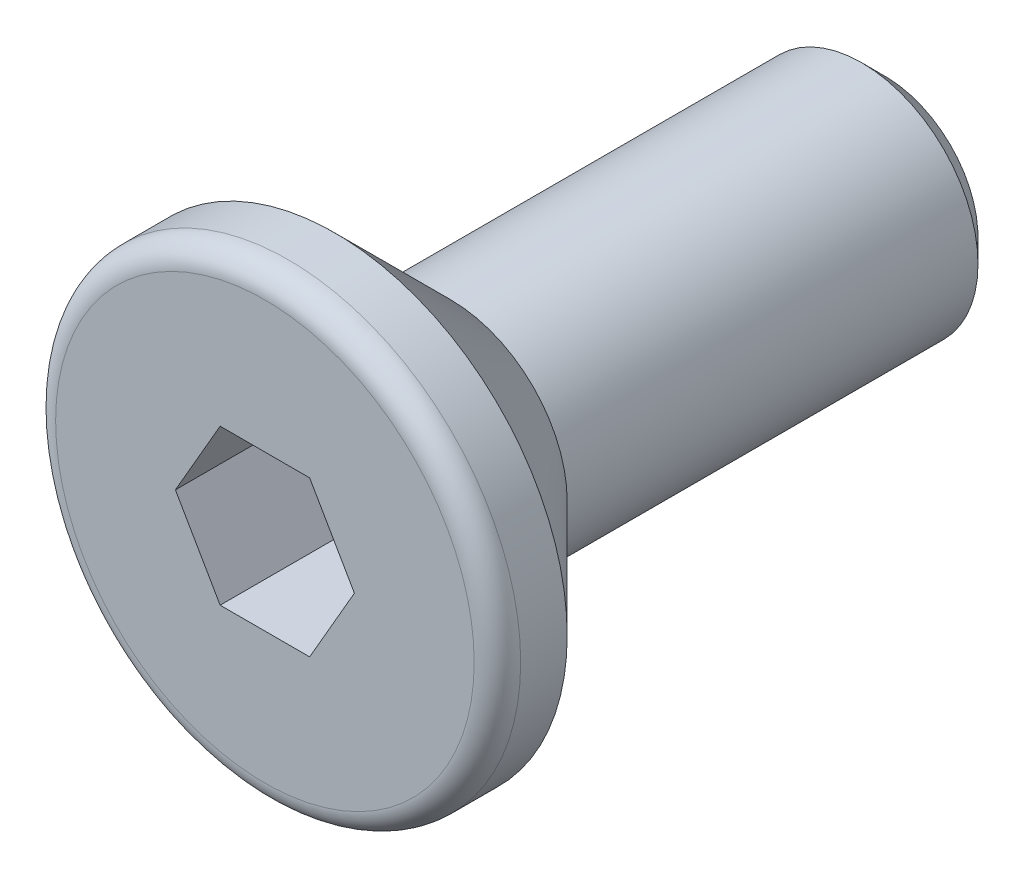
from build123d import *

# Parameters (mm, degrees)
CUT_EXTRUDE_1_DEPTH = 1.5
FILLET_1_R          = 0.3


with BuildPart() as part:
    # 草图1 → 旋转1 (revolve)
    with BuildSketch(Plane(origin=(0, 0, 0), x_dir=(0, 0, -1), z_dir=(1, 0, 0)), mode=Mode.PRIVATE) as revolve_1_sk:
        Polygon((-4, 0), (-4, 3), (-3.1, 3), (-1.6, 1.5), (3.7, 1.5), (4, 1.2), (4, 0), align=None)
    revolve(revolve_1_sk.sketch.rotate(Axis((0, 0, -4), (0, 0, 1)), 90), axis=Axis((0, 0, -4), (0, 0, 1)))

    # 草图2 → 切除-拉伸1 (cut)
    with BuildSketch(Plane.XY.offset(4)):
        Polygon((1.154700538, 0), (0.577350269, 1), (-0.577350269, 1), (-1.154700538, 0), (-0.577350269, -1), (0.577350269, -1), align=None)
    extrude(amount=-CUT_EXTRUDE_1_DEPTH, mode=Mode.SUBTRACT)

    # 圆角1
    fillet_1_edges = [part.edges().sort_by_distance(p)[0] for p in [
        (3, 0, 4),
    ]]
    fillet(fillet_1_edges, radius=FILLET_1_R)


solid = part.part
